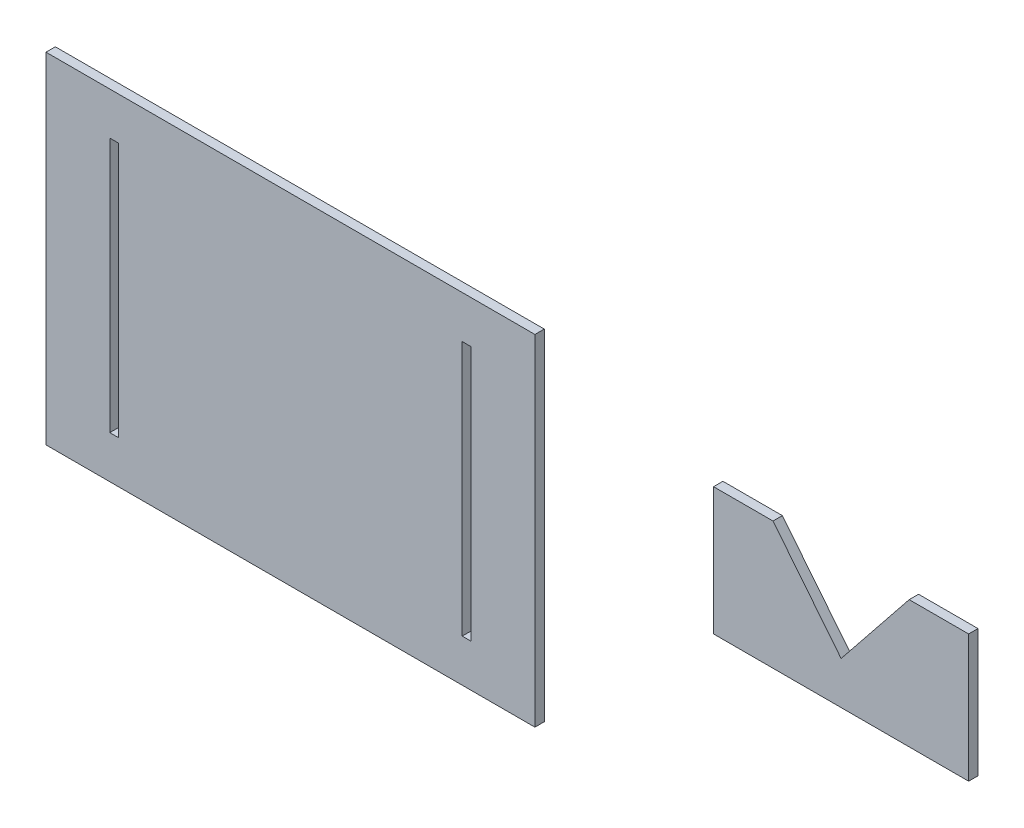
from build123d import *

# Parameters (mm, degrees)
SKETCH1_W             = 115
SKETCH1_H             = 80
SKETCH1_W_2           = 2.1
SKETCH1_H_2           = 60
BOSS_EXTRUDE1_DEPTH   = 2.2
BOSS_EXTRUDE1_2_DEPTH = 2.2


with BuildPart() as part:
    # Sketch1 → Boss-Extrude1 (new body)
    with BuildSketch(Plane.XY):
        Rectangle(SKETCH1_W, SKETCH1_H)
        with Locations((41.45, 0)):
            Rectangle(SKETCH1_W_2, SKETCH1_H_2, mode=Mode.SUBTRACT)
        with Locations((-41.45, 0)):
            Rectangle(SKETCH1_W_2, SKETCH1_H_2, mode=Mode.SUBTRACT)
    extrude(amount=BOSS_EXTRUDE1_DEPTH)


with BuildPart() as body_2:
    # Sketch1 → Boss-Extrude1 2 (new body)
    with BuildSketch(Plane.XY):
        Polygon((113.505737111, 30), (129.518552491, 10), (145.531367872, 30), (159.518552491, 30), (159.518552491, 0), (99.518552491, 0), (99.518552491, 30), align=None)
    extrude(amount=BOSS_EXTRUDE1_2_DEPTH)


solid = Compound([part.part, body_2.part])
